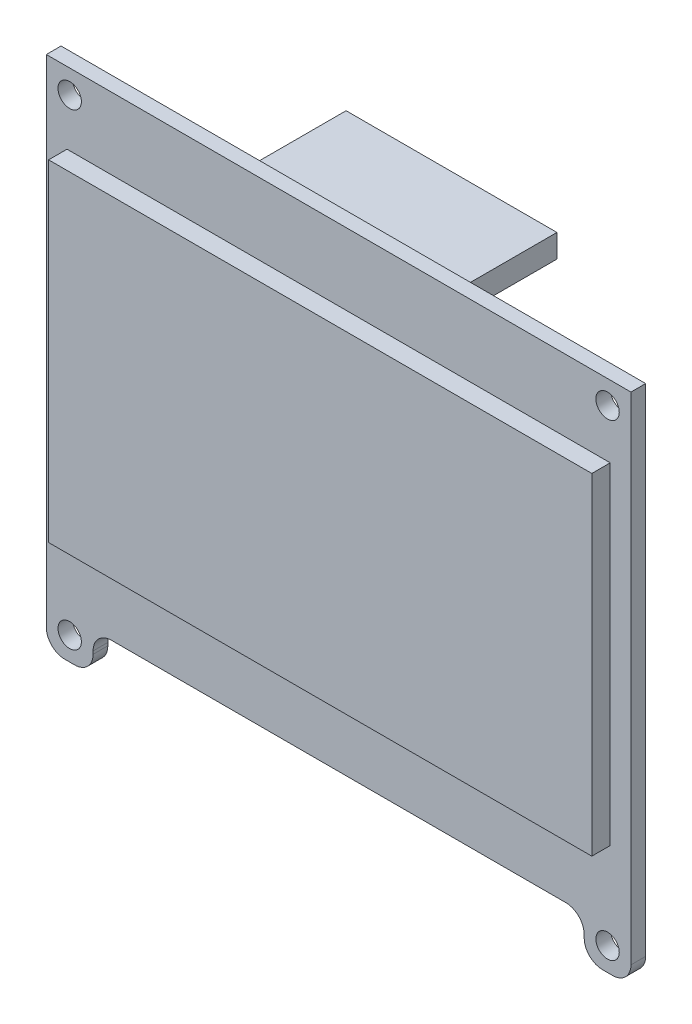
from build123d import *

# Parameters (mm, degrees)
SKETCH1_R           = 1.27
SKETCH1_W           = 59
SKETCH1_H           = 36
BOSS_EXTRUDE1_DEPTH = 1.6
SKETCH1_4_W         = 59
SKETCH1_4_H         = 36
BOSS_EXTRUDE2_DEPTH = 3.6
SKETCH2_W           = 22.9
SKETCH2_H           = 2.51
BOSS_EXTRUDE3_DEPTH = 10.66


with BuildPart() as part:
    # Sketch1 → Boss-Extrude1 (new body)
    # profile 1 of 2: a face of its own
    with BuildSketch(Plane.XY):
        with BuildLine():
            Line((0, 0), (0, -53.88))
            ThreePointArc((0, -53.88), (0.585786438, -55.294213562), (2, -55.88))
            Line((2, -55.88), (3.08, -55.88))
            ThreePointArc((3.08, -55.88), (4.494213562, -55.294213562), (5.08, -53.88))
            Line((5.08, -53.88), (5.08, -53.562))
            ThreePointArc((5.08, -53.562), (5.665786438, -52.147786438), (7.08, -51.562))
            Line((7.08, -51.562), (56.42, -51.562))
            ThreePointArc((56.42, -51.562), (57.834213562, -52.147786438), (58.42, -53.562))
            Line((58.42, -53.562), (58.42, -53.88))
            ThreePointArc((58.42, -53.88), (59.005786438, -55.294213562), (60.42, -55.88))
            Line((60.42, -55.88), (61.5, -55.88))
            ThreePointArc((61.5, -55.88), (62.914213562, -55.294213562), (63.5, -53.88))
            Line((63.5, -53.88), (63.5, 0))
            Line((63.5, 0), (0, 0))
        make_face()
        with Locations((2.54, -2.54)):
            Circle(SKETCH1_R, mode=Mode.SUBTRACT)
        with Locations((60.96, -2.54)):
            Circle(SKETCH1_R, mode=Mode.SUBTRACT)
        with Locations((60.96, -53.34)):
            Circle(SKETCH1_R, mode=Mode.SUBTRACT)
        with Locations((2.54, -53.34)):
            Circle(SKETCH1_R, mode=Mode.SUBTRACT)
        with Locations((31.75, -25.781)):
            Rectangle(SKETCH1_W, SKETCH1_H, mode=Mode.SUBTRACT)
    # profile 2 of 2: a face of its own
    with BuildSketch(Plane.XY):
        with Locations((31.75, -25.781)):
            Rectangle(SKETCH1_W, SKETCH1_H)
    extrude(amount=BOSS_EXTRUDE1_DEPTH)

    # Sketch1<4> → Boss-Extrude2 (add)
    with BuildSketch(Plane.XY):
        with Locations((31.75, -25.781)):
            Rectangle(SKETCH1_4_W, SKETCH1_4_H)
    extrude(amount=BOSS_EXTRUDE2_DEPTH)

    # Sketch2 → Boss-Extrude3 (add)
    with BuildSketch(Plane(origin=(0, 0, 0), x_dir=(-1, 0, 0), z_dir=(0, 0, -1))):
        with Locations((-31.75, -2.521379288)):
            Rectangle(SKETCH2_W, SKETCH2_H)
    extrude(amount=BOSS_EXTRUDE3_DEPTH)


solid = part.part
